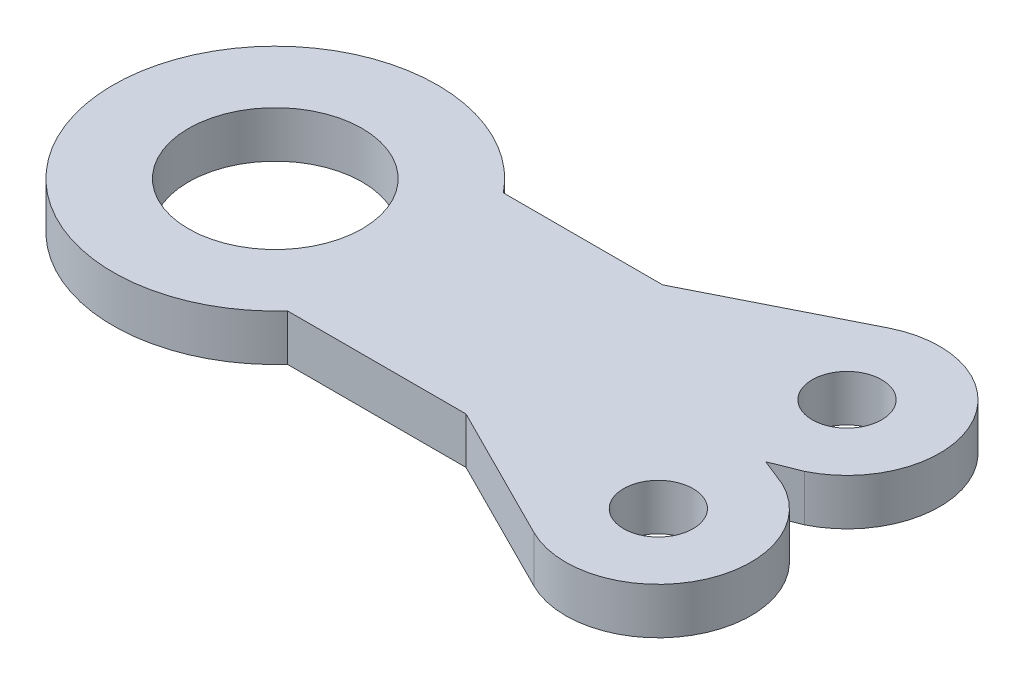
from build123d import *

# Parameters (mm, degrees)
SKETCH1_R           = 7
BOSS_EXTRUDE1_DEPTH = 2
SKETCH2_R           = 3.75
CUT_EXTRUDE1_DEPTH  = 11.099504938
BOSS_EXTRUDE2_START = -2
SKETCH3_R           = 1.5
BOSS_EXTRUDE2_DEPTH = 2


with BuildPart() as part:
    # Sketch1 → Boss-Extrude1 (new body)
    with BuildSketch(Plane(origin=(0, 0, 0), x_dir=(1, 0, 0), z_dir=(0, 1, 0))):
        with Locations(Location((0, 0, 0), (0, 0, 270))):
            Circle(SKETCH1_R)
    extrude(amount=BOSS_EXTRUDE1_DEPTH)

    # Sketch2 → Cut-Extrude1 (cut, through all)
    with BuildSketch(Plane(origin=(0, 2, 0), x_dir=(1, 0, 0), z_dir=(0, 1, 0))):
        with Locations(Location((0, 0, 0), (0, 0, 270))):
            Circle(SKETCH2_R)
    extrude(amount=-CUT_EXTRUDE1_DEPTH, mode=Mode.SUBTRACT)

    # Sketch3 → Boss-Extrude2 (add)
    with BuildSketch(Plane(origin=(0, 2, 0), x_dir=(1, 0, 0), z_dir=(0, 1, 0)).offset(BOSS_EXTRUDE2_START)):
        with BuildLine():
            Line((18.802724006, 7.643943352), (12.328977552, 4.387988089))
            Line((12.328977552, 4.387988089), (5.453949077, 4.387988089))
            ThreePointArc((5.453949077, 4.387988089), (6.602183106, 2.326193937), (7, 0))
            ThreePointArc((7, 0), (6.535978508, -2.506189327), (5.205432874, -4.680114165))
            Line((5.205432874, -4.680114165), (12.909805603, -4.680114165))
            Line((12.909805603, -4.680114165), (18.802724006, -7.643943352))
            ThreePointArc((18.802724006, -7.643943352), (24.183733746, -5.847211141), (22.356172256, -0.476593721))
            Line((22.356172256, -0.476593721), (21.164441, 0))
            Line((21.164441, 0), (22.356172256, 0.476593721))
            ThreePointArc((22.356172256, 0.476593721), (24.183733746, 5.847211141), (18.802724006, 7.643943352))
        make_face()
        with Locations(Location((20.6, -4.070457799, 0), (0, 0, 270))):
            Circle(SKETCH3_R, mode=Mode.SUBTRACT)
        with Locations(Location((20.6, 4.070457799, 0), (0, 0, 270))):
            Circle(SKETCH3_R, mode=Mode.SUBTRACT)
    extrude(amount=BOSS_EXTRUDE2_DEPTH)


solid = part.part
